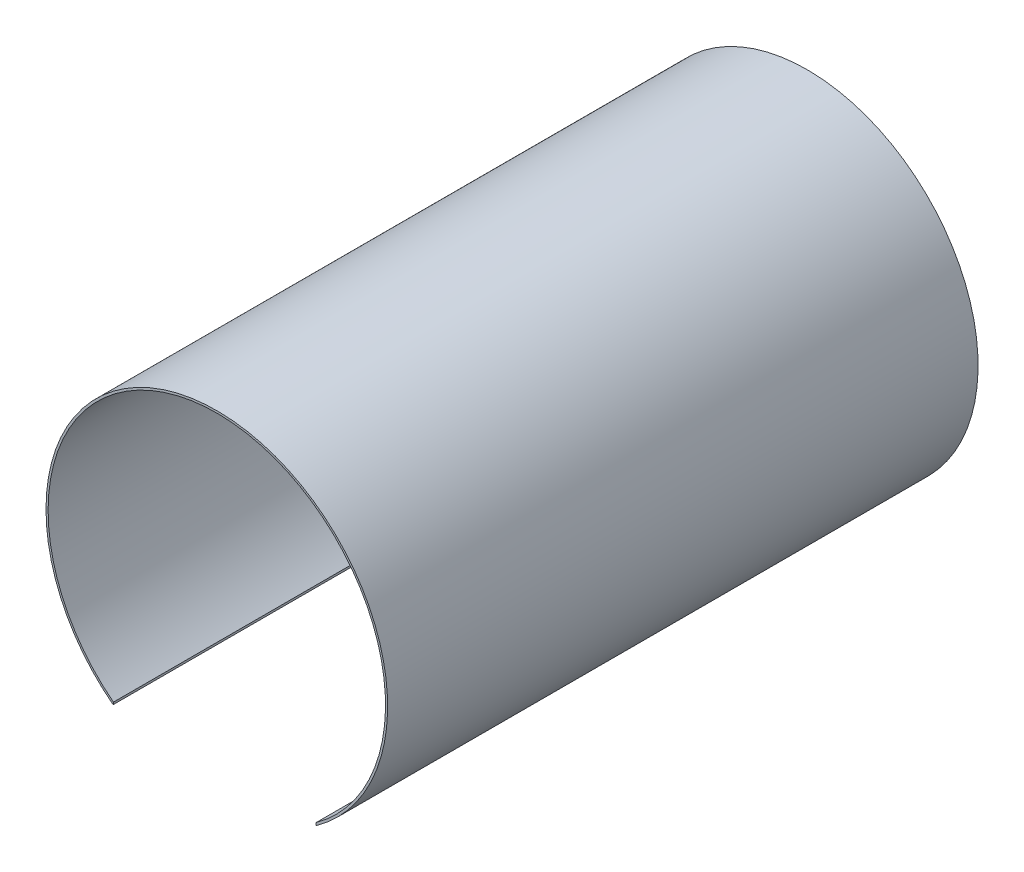
from build123d import *

# Parameters (mm, degrees)
EXTRUDE_THIN1_DEPTH = 889
SKETCH5_W           = 304.838367632
SKETCH5_H           = 889
CUT_EXTRUDE1_DEPTH  = 1035.425821721


with BuildPart() as part:
    # Sketch2 → Extrude-Thin1 (new body)
    with BuildSketch(Plane.XY):
        with BuildLine():
            Line((-156.728695436, -203.89972205), (150.180738454, -208.769553389))
            ThreePointArc((150.180738454, -208.769553389), (4.080165374, 257.142631385), (-156.728695436, -203.89972205))
        make_face()
        with BuildLine():
            Line((-155.623606079, -200.741857197), (149.176393921, -205.578217466))
            ThreePointArc((149.176393921, -205.578217466), (4.029792962, 253.968030997), (-155.623606079, -200.741857197))
        make_face(mode=Mode.SUBTRACT)
    extrude(amount=EXTRUDE_THIN1_DEPTH)

    # Sketch5 → Cut-Extrude1 (cut, through all)
    with BuildSketch(Plane(origin=(-3.223606079, -203.160037332, 0), x_dir=(0.9998741377849476, -0.01586532662152281, 0), z_dir=(0.01586532662152281, 0.9998741377849476, 0))):
        with Locations((0, -444.5)):
            Rectangle(SKETCH5_W, SKETCH5_H)
    extrude(amount=-CUT_EXTRUDE1_DEPTH, mode=Mode.SUBTRACT)


solid = part.part
